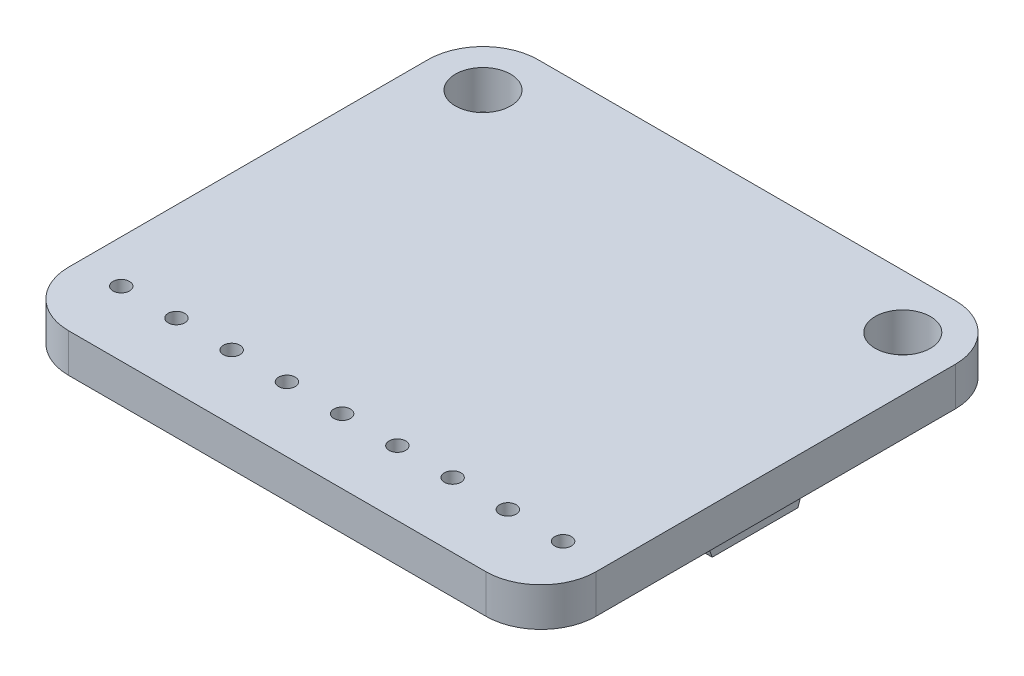
from build123d import *

# Parameters (mm, degrees)
SKETCH1_R           = 1.27
BOSS_EXTRUDE1_DEPTH = 1.778
SKETCH2_W           = 13.208
SKETCH2_H           = 2.667
BOSS_EXTRUDE2_DEPTH = 2.159
SKETCH3_R           = 0.381
CUT_EXTRUDE1_DEPTH  = 17.707259088
SKETCH4_W           = 8.324333024
SKETCH4_H           = 3.537443828
CUT_EXTRUDE2_DEPTH  = 27.638231079
CUT_EXTRUDE3_DEPTH  = 0.0254
SKETCH7_W           = 7.62
SKETCH7_H           = 6.858
BOSS_EXTRUDE3_DEPTH = 8.636
CUT_EXTRUDE4_DEPTH  = 22.098538068


with BuildPart() as part:
    # Sketch1 → Boss-Extrude1 (new body)
    with BuildSketch(Plane(origin=(0, 0, 0), x_dir=(1, 0, 0), z_dir=(0, 1, 0))):
        with BuildLine():
            Line((9.5885, 10.795), (-9.5885, 10.795))
            ThreePointArc((-9.5885, 10.795), (-11.384551224, 10.051051224), (-12.1285, 8.255))
            Line((-12.1285, 8.255), (-12.1285, -8.255))
            ThreePointArc((-12.1285, -8.255), (-11.384551224, -10.051051224), (-9.5885, -10.795))
            Line((-9.5885, -10.795), (9.5885, -10.795))
            ThreePointArc((9.5885, -10.795), (11.384551224, -10.051051224), (12.1285, -8.255))
            Line((12.1285, -8.255), (12.1285, 8.255))
            ThreePointArc((12.1285, 8.255), (11.384551224, 10.051051224), (9.5885, 10.795))
        make_face()
        with Locations(Location((-9.652, 8.3185, 0), (0, 0, 270))):
            Circle(SKETCH1_R, mode=Mode.SUBTRACT)
        with Locations(Location((9.652, 8.3185, 0), (0, 0, 270))):
            Circle(SKETCH1_R, mode=Mode.SUBTRACT)
    extrude(amount=BOSS_EXTRUDE1_DEPTH)

    # Sketch2 → Boss-Extrude2 (add)
    with BuildSketch(Plane.XZ):
        with Locations((0, 7.8105)):
            Rectangle(SKETCH2_W, SKETCH2_H)
    extrude(amount=BOSS_EXTRUDE2_DEPTH)

    # Sketch3 → Cut-Extrude1 (cut, through all)
    with BuildSketch(Plane.XZ.offset(2.159)):
        with Locations(Location((-10.16, 7.8105, 0), (0, 0, 270))):
            Circle(SKETCH3_R)
        with Locations(Location((-7.62, 7.8105, 0), (0, 0, 270))):
            Circle(SKETCH3_R)
        with Locations(Location((-5.08, 7.8105, 0), (0, 0, 270))):
            Circle(SKETCH3_R)
        with Locations(Location((7.62, 7.8105, 0), (0, 0, 270))):
            Circle(SKETCH3_R)
        with Locations(Location((10.16, 7.8105, 0), (0, 0, 270))):
            Circle(SKETCH3_R)
        with Locations(Location((-2.54, 7.8105, 0), (0, 0, 270))):
            Circle(SKETCH3_R)
        with Locations(Location((2.54, 7.8105, 0), (0, 0, 270))):
            Circle(SKETCH3_R)
        with Locations(Location((5.08, 7.8105, 0), (0, 0, 270))):
            Circle(SKETCH3_R)
        with Locations(Location((0, 7.8105, 0), (0, 0, 270))):
            Circle(SKETCH3_R)
    extrude(amount=-CUT_EXTRUDE1_DEPTH, mode=Mode.SUBTRACT)

    # Sketch4 → Cut-Extrude2 (cut, through all)
    with BuildSketch(Plane.ZY.offset(12.1285)):
        with Locations((7.529971696, -1.768721914)):
            Rectangle(SKETCH4_W, SKETCH4_H)
    extrude(amount=-CUT_EXTRUDE2_DEPTH, mode=Mode.SUBTRACT)

    # Sketch5 → Cut-Extrude3 (cut)
    # profile 1 of 8: a face of its own
    with BuildSketch(Plane.XZ):
        Polygon((-10.354641993, -1.090005859), (-9.935506376, 2.084994141), (-9.894801248, 2.084994141), (-8.583968916, -0.520134064), (-7.276316672, 2.084994141), (-7.234975526, 2.084994141), (-6.813295839, -1.090005859), (-7.099503772, -1.090005859), (-7.403520198, 1.194569461), (-8.549623964, -1.090005859), (-8.613861744, -1.090005859), (-9.764417634, 1.199657602), (-10.067798042, -1.090005859), align=None)
    # profile 2 of 8: a face of its own
    with BuildSketch(Plane.XZ):
        Polygon((-4.859449685, 2.084994141), (-3.39406507, -1.090005859), (-3.703805655, -1.090005859), (-4.173186664, -0.072377654), (-5.612494557, -0.072377654), (-6.095231937, -1.090005859), (-6.406244557, -1.090005859), (-4.900154813, 2.084994141), align=None)
        Polygon((-4.882982337, 1.466148989), (-5.457942273, 0.253263372), (-4.323286825, 0.253263372), align=None, mode=Mode.SUBTRACT)
    # profile 3 of 8: a face of its own
    with BuildSketch(Plane.XZ):
        Polygon((-3.04807148, 2.084994141), (-2.719250366, 2.084994141), (-1.887975326, 0.786246144), (-1.056700286, 2.084994141), (-0.727879172, 2.084994141), (-1.72324676, 0.529295022), (-0.687174044, -1.090005859), (-1.015995158, -1.090005859), (-1.887975326, 0.2723439), (-2.759955494, -1.090005859), (-3.088776608, -1.090005859), (-2.052067874, 0.529295022), align=None)
    # profile 4 of 8: a face of its own
    with BuildSketch(Plane.XZ):
        with BuildLine():
            Line((-0.015539429, 1.352301833), (-0.300475326, 1.352301833))
            add(Edge.make_bspline(
                [(-0.300475326, 1.352301833), (-0.292755948, 1.384262729), (-0.277665195, 1.446743667), (-0.246189539, 1.536013111), (-0.211900215, 1.620489448), (-0.170725813, 1.698590886), (-0.1258143, 1.771887034), (-0.074358688, 1.838715454), (-0.01873294, 1.900775787), (0.042793978, 1.955851367), (0.107317836, 2.005724021), (0.175747812, 2.048246395), (0.246707151, 2.084826162), (0.320687493, 2.114961658), (0.397909092, 2.137663383), (0.477673822, 2.154134199), (0.560190711, 2.164830424), (0.616204597, 2.165874331), (0.644646869, 2.166404397)],
                knots=[0, 0, 0, 0, 1.162005537, 2.271625781, 3.343758855, 4.383309926, 5.390229558, 6.379919256, 7.361854164, 8.333198761, 9.295911338, 10.242430842, 11.177959212, 12.116337295, 13.062827104, 14.020064771, 14.994644689, 16, 16, 16, 16], degree=3))
            add(Edge.make_bspline(
                [(0.644646869, 2.166404397), (0.686087643, 2.165153238), (0.768065245, 2.162678212), (0.888500295, 2.140077259), (1.00463891, 2.104313032), (1.11520987, 2.054897579), (1.217915162, 1.993949088), (1.309297275, 1.921409648), (1.388117567, 1.838678853), (1.454243181, 1.747300027), (1.506018358, 1.649641101), (1.544196712, 1.54912953), (1.567439236, 1.446003741), (1.570451456, 1.376373924), (1.571960571, 1.341489533)],
                knots=[0, 0, 0, 0, 1.083050992, 2.142477498, 3.193116406, 4.255571735, 5.30263384, 6.308962982, 7.297363603, 8.282367274, 9.249857812, 10.179914175, 11.08814088, 12, 12, 12, 12], degree=3))
            add(Edge.make_bspline(
                [(1.571960571, 1.341489533), (1.570905028, 1.307919084), (1.568839494, 1.242226924), (1.551301061, 1.146322423), (1.521786022, 1.055933257), (1.480901309, 0.970678917), (1.427977188, 0.891099955), (1.363866956, 0.817017326), (1.288118113, 0.748102446), (1.230715076, 0.708624067), (1.201162294, 0.688299429)],
                knots=[0, 0, 0, 0, 1.024540389, 2.004866551, 2.965041327, 3.920577974, 4.882998113, 5.874504559, 6.905732034, 8, 8, 8, 8], degree=3))
            add(Edge.make_bspline(
                [(1.201162294, 0.688299429), (1.234936814, 0.671990659), (1.301853907, 0.639678269), (1.393067602, 0.576309118), (1.475869675, 0.503142288), (1.52204662, 0.44604431), (1.545247831, 0.41735592)],
                knots=[0, 0, 0, 0, 1.015518401, 2.012035669, 3.001164323, 4, 4, 4, 4], degree=3))
            add(Edge.make_bspline(
                [(1.545247831, 0.41735592), (1.560525334, 0.396439245), (1.590830161, 0.354948421), (1.628236681, 0.288240377), (1.662172092, 0.220792955), (1.688615505, 0.150798351), (1.709093228, 0.079067831), (1.723730914, 0.005478229), (1.732824242, -0.070030548), (1.734126492, -0.121114013), (1.734781084, -0.146791717)],
                knots=[0, 0, 0, 0, 1.025084078, 2.033381695, 3.024893161, 4.013698104, 4.991890475, 5.976764909, 6.982997093, 8, 8, 8, 8], degree=3))
            add(Edge.make_bspline(
                [(1.734781084, -0.146791717), (1.733153204, -0.191250535), (1.729905105, -0.279958948), (1.700872837, -0.41101816), (1.65586654, -0.539129866), (1.591952034, -0.661662041), (1.514057937, -0.776307101), (1.42138665, -0.878883467), (1.314991122, -0.967056487), (1.196331712, -1.040725765), (1.067774031, -1.099615594), (0.930273316, -1.140489132), (0.785810767, -1.167110146), (0.686744147, -1.169964806), (0.63637864, -1.171416116)],
                knots=[0, 0, 0, 0, 0.955779014, 1.907060117, 2.875433937, 3.871313158, 4.872415639, 5.851225146, 6.836215519, 7.83643374, 8.849228613, 9.86973379, 10.916971861, 12, 12, 12, 12], degree=3))
            add(Edge.make_bspline(
                [(0.63637864, -1.171416116), (0.602433989, -1.170628522), (0.535642235, -1.169078801), (0.437449919, -1.158484641), (0.343722377, -1.139135279), (0.254332885, -1.113097281), (0.169202031, -1.080084772), (0.088589592, -1.038974239), (0.011999618, -0.99061309), (-0.059845145, -0.934430479), (-0.126936132, -0.871582406), (-0.187490389, -0.800953161), (-0.242517487, -0.723848374), (-0.290544023, -0.639372458), (-0.333757544, -0.548617118), (-0.369300269, -0.450420266), (-0.400583607, -0.34565976), (-0.415128249, -0.272654953), (-0.422590711, -0.235198167)],
                knots=[0, 0, 0, 0, 1.048658725, 2.063410685, 3.046034179, 4.001477787, 4.936774919, 5.862367409, 6.792675028, 7.730719943, 8.675894397, 9.627829632, 10.600096036, 11.597688215, 12.626045268, 13.701542398, 14.82072376, 16, 16, 16, 16], degree=3))
            Line((-0.422590711, -0.235198167), (-0.137654813, -0.235198167))
            add(Edge.make_bspline(
                [(-0.137654813, -0.235198167), (-0.130231399, -0.259644772), (-0.115792213, -0.307195542), (-0.091213814, -0.375630676), (-0.063211882, -0.43836691), (-0.033172246, -0.495864457), (-0.001623227, -0.548689564), (0.033678169, -0.595445403), (0.070117322, -0.638185622), (0.097585021, -0.662265377), (0.111028079, -0.67405033)],
                knots=[0, 0, 0, 0, 1.198163088, 2.33053128, 3.407730985, 4.417276592, 5.372219308, 6.28897303, 7.162600585, 8, 8, 8, 8], degree=3))
            add(Edge.make_bspline(
                [(0.111028079, -0.67405033), (0.128804974, -0.687755747), (0.164303889, -0.715124276), (0.222150785, -0.750050754), (0.282988217, -0.780313969), (0.348134386, -0.803431322), (0.416183499, -0.823005343), (0.488235466, -0.835814671), (0.563654613, -0.844603226), (0.615151084, -0.845378771), (0.641466781, -0.84577509)],
                knots=[0, 0, 0, 0, 0.946170439, 1.889420265, 2.845303464, 3.807233317, 4.801018734, 5.828864929, 6.890507805, 8, 8, 8, 8], degree=3))
            add(Edge.make_bspline(
                [(0.641466781, -0.84577509), (0.671178887, -0.845216376), (0.729278345, -0.844123859), (0.814055254, -0.83407661), (0.89470701, -0.819444021), (0.970338164, -0.796844387), (1.04193941, -0.768921757), (1.108507049, -0.733862132), (1.170914945, -0.692727992), (1.228363763, -0.645974612), (1.280021473, -0.594792256), (1.325505175, -0.54125897), (1.364171832, -0.485600468), (1.395362649, -0.427508744), (1.419992077, -0.367224357), (1.43675898, -0.304578134), (1.448417141, -0.240082756), (1.449366567, -0.196241477), (1.449845187, -0.174140475)],
                knots=[0, 0, 0, 0, 1.217147791, 2.380027433, 3.494444702, 4.572153297, 5.609568379, 6.639424714, 7.649109417, 8.668170816, 9.669597737, 10.625200337, 11.543417969, 12.441394052, 13.322311151, 14.205496177, 15.095365482, 16, 16, 16, 16], degree=3))
            add(Edge.make_bspline(
                [(1.449845187, -0.174140475), (1.448456985, -0.144557331), (1.445687488, -0.085538247), (1.424543277, 0.001291267), (1.38976445, 0.084951077), (1.341075814, 0.164013829), (1.281806975, 0.237289111), (1.212533095, 0.302668242), (1.132678917, 0.35661611), (1.059182321, 0.393889391), (0.994081072, 0.419323024), (0.938368545, 0.436263885), (0.875996483, 0.450609129), (0.807719152, 0.463955261), (0.733022092, 0.475313913), (0.651986623, 0.484786131), (0.564596325, 0.492365347), (0.50409791, 0.495749984), (0.47292211, 0.497494141)],
                knots=[0, 0, 0, 0, 1.07054697, 2.135767047, 3.216561865, 4.33974944, 5.486079747, 6.621378074, 7.775625952, 8.963672916, 9.598146892, 10.304877434, 11.070270905, 11.915000392, 12.823868403, 13.805723172, 14.86925407, 16, 16, 16, 16], degree=3))
            Line((0.47292211, 0.497494141), (0.47292211, 0.823135166))
            add(Edge.make_bspline(
                [(0.47292211, 0.823135166), (0.512202453, 0.823801738), (0.589142996, 0.825107389), (0.70153283, 0.840898941), (0.809005048, 0.862743511), (0.909177879, 0.89620365), (1.00048064, 0.935065919), (1.079691993, 0.980288995), (1.145702191, 1.030558089), (1.198190449, 1.086649099), (1.237677678, 1.14680632), (1.26654913, 1.209505003), (1.283603711, 1.275294687), (1.285880338, 1.320193421), (1.287024674, 1.342761569)],
                knots=[0, 0, 0, 0, 1.321986639, 2.589447074, 3.816329219, 5.01088745, 6.139805852, 7.153945165, 8.075214402, 8.924034688, 9.728124013, 10.488707548, 11.240355623, 12, 12, 12, 12], degree=3))
            add(Edge.make_bspline(
                [(1.287024674, 1.342761569), (1.286648744, 1.359342095), (1.285900849, 1.392328265), (1.276469033, 1.440520291), (1.262295796, 1.487239007), (1.242810613, 1.532285734), (1.216730075, 1.575348054), (1.18551893, 1.616793097), (1.148355011, 1.65638424), (1.105768784, 1.693287101), (1.060038075, 1.728456338), (1.009918636, 1.758313708), (0.95692165, 1.7838453), (0.900988442, 1.804899634), (0.841937496, 1.820737703), (0.780046262, 1.832109502), (0.71519672, 1.839219374), (0.670953792, 1.840243009), (0.648462975, 1.840763372)],
                knots=[0, 0, 0, 0, 0.884392785, 1.759457502, 2.611959086, 3.489218968, 4.37281399, 5.2945488, 6.255912374, 7.266815255, 8.301784654, 9.332968512, 10.37626691, 11.440494194, 12.520033166, 13.637162961, 14.798855837, 16, 16, 16, 16], degree=3))
            add(Edge.make_bspline(
                [(0.648462975, 1.840763372), (0.612311819, 1.839501208), (0.541700203, 1.837035907), (0.439905243, 1.815443174), (0.345272704, 1.780991627), (0.272938343, 1.739868102), (0.219523436, 1.699273065), (0.181353642, 1.663819758), (0.143870036, 1.624419982), (0.109538601, 1.578647027), (0.074818636, 1.529600725), (0.043209641, 1.474787814), (0.012494063, 1.415638113), (-0.006013964, 1.373822788), (-0.015539429, 1.352301833)],
                knots=[0, 0, 0, 0, 1.472543308, 2.876219568, 4.221790263, 5.565193594, 6.249813518, 6.953379497, 7.687249741, 8.463570142, 9.283606569, 10.136032583, 11.040678096, 12, 12, 12, 12], degree=3))
        make_face()
    # profile 5 of 8: a face of its own
    with BuildSketch(Plane.XZ):
        Polygon((2.694531685, 2.084994141), (3.281575956, 2.084994141), (3.281575956, -1.090005859), (2.996640058, -1.090005859), (2.996640058, 1.759353115), (2.50817852, 1.759353115), align=None)
    # profile 6 of 8: a face of its own
    with BuildSketch(Plane.XZ):
        with BuildLine():
            add(Edge.make_bspline(
                [(6.005639458, 0.678759165), (6.031627782, 0.665208305), (6.082313695, 0.638779602), (6.154501591, 0.59622478), (6.220473557, 0.551374762), (6.282059995, 0.506347946), (6.338178892, 0.459419948), (6.388202752, 0.410404157), (6.433367236, 0.360524049), (6.472761533, 0.30893498), (6.50741152, 0.255774005), (6.537358243, 0.200901593), (6.562955277, 0.144437998), (6.583241657, 0.085766873), (6.599952854, 0.025750065), (6.611451438, -0.03638739), (6.617635357, -0.100236042), (6.618804495, -0.143387287), (6.619396469, -0.165236228)],
                knots=[0, 0, 0, 0, 1.272397273, 2.481599622, 3.635517121, 4.734568067, 5.792894095, 6.808321871, 7.773003508, 8.711915296, 9.623354172, 10.525449501, 11.423591555, 12.311487226, 13.218079475, 14.126165749, 15.051214107, 16, 16, 16, 16], degree=3))
            add(Edge.make_bspline(
                [(6.619396469, -0.165236228), (6.61869668, -0.195804885), (6.617311536, -0.256311728), (6.60524655, -0.345616415), (6.587182634, -0.43234996), (6.560803362, -0.516493348), (6.526591929, -0.59758228), (6.484430799, -0.675686167), (6.43670492, -0.752085112), (6.398376103, -0.799092712), (6.378981805, -0.822878455)],
                knots=[0, 0, 0, 0, 1.025265484, 2.029385089, 3.018602448, 3.995076438, 4.983346944, 5.966715145, 6.97116228, 8, 8, 8, 8], degree=3))
            add(Edge.make_bspline(
                [(6.378981805, -0.822878455), (6.353730146, -0.850631379), (6.303538871, -0.905794276), (6.217557215, -0.977413939), (6.123194506, -1.037602318), (6.020815876, -1.086653251), (5.910694991, -1.124831137), (5.792855315, -1.152265422), (5.667067119, -1.167979339), (5.580611442, -1.170250816), (5.536258448, -1.171416116)],
                knots=[0, 0, 0, 0, 0.954267603, 1.896743057, 2.838368354, 3.796610408, 4.779680527, 5.799409237, 6.871065594, 8, 8, 8, 8], degree=3))
            add(Edge.make_bspline(
                [(5.536258448, -1.171416116), (5.493610588, -1.170370653), (5.410622185, -1.16833629), (5.289828968, -1.15455277), (5.177231611, -1.130397491), (5.072175426, -1.097337024), (4.975293754, -1.054329174), (4.886862655, -1.000800118), (4.805606266, -0.938904452), (4.733990536, -0.866864538), (4.670410305, -0.789704897), (4.614559286, -0.710101651), (4.568137086, -0.628047534), (4.528833221, -0.544766044), (4.498745086, -0.45908989), (4.477906009, -0.371459878), (4.464671417, -0.28202907), (4.462910531, -0.221675355), (4.462024674, -0.19131295)],
                knots=[0, 0, 0, 0, 1.256902934, 2.445805442, 3.576955095, 4.645999104, 5.686449165, 6.692658513, 7.68621702, 8.689161843, 9.678783111, 10.630372946, 11.551080876, 12.453998257, 13.34127905, 14.221779781, 15.105423033, 16, 16, 16, 16], degree=3))
            add(Edge.make_bspline(
                [(4.462024674, -0.19131295), (4.462548895, -0.169034255), (4.46358494, -0.125003689), (4.470755766, -0.059953084), (4.482284156, 0.003361981), (4.497940949, 0.06517537), (4.519159952, 0.125037067), (4.544779601, 0.183230711), (4.574653586, 0.239822001), (4.609198643, 0.295120415), (4.649386908, 0.348351115), (4.694892504, 0.400417482), (4.746624928, 0.450511604), (4.804008662, 0.499245518), (4.866387922, 0.547483723), (4.935382968, 0.592619277), (5.009164768, 0.637847573), (5.061602529, 0.664887983), (5.088502038, 0.678759165)],
                knots=[0, 0, 0, 0, 0.941657376, 1.861047343, 2.762797495, 3.66048619, 4.553285746, 5.444104102, 6.34607688, 7.256116206, 8.197091036, 9.162375105, 10.176350973, 11.237807142, 12.343728897, 13.50695164, 14.721116704, 16, 16, 16, 16], degree=3))
            add(Edge.make_bspline(
                [(5.088502038, 0.678759165), (5.051679862, 0.698838562), (4.980381824, 0.737717895), (4.885975973, 0.809152498), (4.804885908, 0.88652073), (4.739340557, 0.97145633), (4.687749321, 1.061305994), (4.652353873, 1.155507566), (4.628408491, 1.252314326), (4.626036469, 1.318450662), (4.624845187, 1.351665816)],
                knots=[0, 0, 0, 0, 1.166880483, 2.259407225, 3.286803203, 4.280235371, 5.237608625, 6.161067461, 7.076446754, 8, 8, 8, 8], degree=3))
            add(Edge.make_bspline(
                [(4.624845187, 1.351665816), (4.62632875, 1.385500029), (4.629310971, 1.453512699), (4.65342584, 1.554755397), (4.692723329, 1.654193281), (4.746173091, 1.751344392), (4.81274578, 1.842920658), (4.892616575, 1.925054231), (4.983878137, 1.997001075), (5.086074916, 2.057395175), (5.196053502, 2.106547494), (5.312091337, 2.140455063), (5.432166656, 2.162622112), (5.513898158, 2.165131863), (5.555338977, 2.166404397)],
                knots=[0, 0, 0, 0, 0.888701115, 1.786444228, 2.72001202, 3.692817113, 4.693886446, 5.687152267, 6.695133018, 7.739871481, 8.800368666, 9.853104506, 10.91144658, 12, 12, 12, 12], degree=3))
            add(Edge.make_bspline(
                [(5.555338977, 2.166404397), (5.595710295, 2.165092357), (5.675317934, 2.162505164), (5.792334489, 2.140927068), (5.904298485, 2.104886718), (6.010823816, 2.055994237), (6.110003439, 1.995771797), (6.197635534, 1.922836719), (6.275044376, 1.841065455), (6.339074505, 1.749516958), (6.391836555, 1.652739153), (6.428576658, 1.551481581), (6.452118806, 1.447932078), (6.455088215, 1.377866174), (6.456575956, 1.342761569)],
                knots=[0, 0, 0, 0, 1.072916533, 2.115669174, 3.151510826, 4.193348718, 5.225979165, 6.227137561, 7.216255879, 8.211077061, 9.189680878, 10.138522389, 11.067357538, 12, 12, 12, 12], degree=3))
            add(Edge.make_bspline(
                [(6.456575956, 1.342761569), (6.455274604, 1.308311309), (6.452718824, 1.240652958), (6.431219593, 1.142022472), (6.395012516, 1.049655336), (6.345578525, 0.962503444), (6.281148262, 0.882147371), (6.202581768, 0.807565288), (6.110505427, 0.738144522), (6.041325909, 0.69896832), (6.005639458, 0.678759165)],
                knots=[0, 0, 0, 0, 0.975232327, 1.915300861, 2.843280834, 3.77672583, 4.742871857, 5.749627742, 6.839139064, 8, 8, 8, 8], degree=3))
        make_face()
        with BuildLine():
            add(Edge.make_bspline(
                [(5.539438536, 1.840763372), (5.517167448, 1.840172422), (5.473595461, 1.839016266), (5.409706595, 1.832975931), (5.348953091, 1.821225513), (5.290700186, 1.805587539), (5.235746549, 1.784462007), (5.183345846, 1.75961082), (5.134389895, 1.72939746), (5.088287713, 1.695505517), (5.046785225, 1.65822838), (5.009951096, 1.619390221), (4.979354878, 1.578228258), (4.9533733, 1.535766389), (4.934521495, 1.490744367), (4.920402448, 1.444542514), (4.910858043, 1.396576987), (4.91014286, 1.363796009), (4.909781084, 1.347213692)],
                knots=[0, 0, 0, 0, 1.203892937, 2.355340988, 3.463153438, 4.544400666, 5.610487187, 6.640501085, 7.674077295, 8.714426146, 9.728707835, 10.68524104, 11.601827946, 12.495867327, 13.368432065, 14.231010473, 15.105153427, 16, 16, 16, 16], degree=3))
            add(Edge.make_bspline(
                [(4.909781084, 1.347213692), (4.910404624, 1.330630658), (4.911636829, 1.297860202), (4.921166481, 1.24946788), (4.935369485, 1.201913967), (4.957731156, 1.156329212), (4.984552067, 1.111132308), (5.017655049, 1.067452848), (5.05710581, 1.02513882), (5.101580702, 0.984550127), (5.150032597, 0.946541963), (5.201362408, 0.913546291), (5.25492592, 0.885938205), (5.310172797, 0.862960817), (5.367666103, 0.845099231), (5.427053546, 0.832427673), (5.488345109, 0.824551861), (5.529874636, 0.823611135), (5.550886853, 0.823135166)],
                knots=[0, 0, 0, 0, 0.873023192, 1.725219244, 2.590779336, 3.480155217, 4.391973325, 5.357036234, 6.360879153, 7.436073238, 8.526419356, 9.601555421, 10.645666583, 11.697338044, 12.750135903, 13.812665442, 14.89329948, 16, 16, 16, 16], degree=3))
            add(Edge.make_bspline(
                [(5.550886853, 0.823135166), (5.577874448, 0.823926982), (5.631583081, 0.825502791), (5.710757903, 0.840154213), (5.787740445, 0.86320101), (5.86170788, 0.894733265), (5.930745611, 0.934309967), (5.992286244, 0.981692776), (6.045804854, 1.035787607), (6.090745265, 1.095752322), (6.125588482, 1.159571263), (6.152713694, 1.223615814), (6.168553511, 1.288569267), (6.170619589, 1.332082155), (6.171640058, 1.353573868)],
                knots=[0, 0, 0, 0, 1.076279235, 2.141928126, 3.20205304, 4.278698113, 5.344010996, 6.36967002, 7.368914609, 8.37248503, 9.349703398, 10.264243087, 11.142681841, 12, 12, 12, 12], degree=3))
            add(Edge.make_bspline(
                [(6.171640058, 1.353573868), (6.171157551, 1.368657872), (6.170199844, 1.398597458), (6.16230765, 1.442810118), (6.149266716, 1.486016955), (6.131610922, 1.5285749), (6.10837918, 1.56988685), (6.080834524, 1.610602223), (6.047375012, 1.649805094), (6.009822533, 1.688409056), (5.967236341, 1.724135992), (5.919698506, 1.755554622), (5.867452747, 1.782235831), (5.810497828, 1.803906344), (5.749043504, 1.820182619), (5.683372825, 1.832371306), (5.61293822, 1.8392412), (5.564469803, 1.840244976), (5.539438536, 1.840763372)],
                knots=[0, 0, 0, 0, 0.814439003, 1.616544685, 2.417341072, 3.248991801, 4.09997495, 4.973547432, 5.9003056, 6.880240646, 7.880314356, 8.896779544, 9.951930927, 11.043077905, 12.18215768, 13.381699519, 14.647792085, 16, 16, 16, 16], degree=3))
        make_face(mode=Mode.SUBTRACT)
        with BuildLine():
            add(Edge.make_bspline(
                [(5.557883047, 0.497494141), (5.529647513, 0.496991909), (5.474256285, 0.496006653), (5.393106072, 0.485039749), (5.315224986, 0.469773085), (5.240875615, 0.446612967), (5.170089356, 0.416499008), (5.102483008, 0.380272676), (5.038573769, 0.337450595), (4.979244153, 0.288576808), (4.925066561, 0.235908589), (4.877533818, 0.180153652), (4.83716821, 0.122348212), (4.804662332, 0.061758118), (4.777981689, -0.000333643), (4.760461244, -0.06547339), (4.749229262, -0.132408843), (4.747721018, -0.177911218), (4.746960571, -0.200853215)],
                knots=[0, 0, 0, 0, 1.140299081, 2.23698856, 3.303958914, 4.344563908, 5.37730929, 6.408454204, 7.439741482, 8.480804886, 9.510774543, 10.48932336, 11.43758569, 12.353841022, 13.263987381, 14.161954604, 15.073269652, 16, 16, 16, 16], degree=3))
            add(Edge.make_bspline(
                [(4.746960571, -0.200853215), (4.748197242, -0.229365537), (4.750650767, -0.285933318), (4.770115004, -0.369538389), (4.801352954, -0.450474632), (4.844918685, -0.528082475), (4.898864269, -0.600608643), (4.965200422, -0.663826318), (5.039804611, -0.719997945), (5.125201093, -0.765428143), (5.218481201, -0.80170919), (5.319620127, -0.826706385), (5.427166374, -0.843253986), (5.501424719, -0.844921479), (5.539438536, -0.84577509)],
                knots=[0, 0, 0, 0, 0.898778495, 1.783155532, 2.693654817, 3.627872908, 4.583023416, 5.533784346, 6.509005473, 7.520592997, 8.575161974, 9.658835044, 10.801527049, 12, 12, 12, 12], degree=3))
            add(Edge.make_bspline(
                [(5.539438536, -0.84577509), (5.569147798, -0.845204671), (5.627030968, -0.844093312), (5.711473222, -0.834283202), (5.791160777, -0.818726042), (5.865939101, -0.796098683), (5.936645299, -0.768476204), (6.002080556, -0.73294153), (6.063928219, -0.692526209), (6.119140674, -0.644576309), (6.169426513, -0.593341339), (6.213271714, -0.539103229), (6.251333207, -0.483336048), (6.281206288, -0.424779537), (6.305087961, -0.364557121), (6.322254329, -0.302113479), (6.332846324, -0.237257089), (6.333917565, -0.193261503), (6.334460571, -0.170960386)],
                knots=[0, 0, 0, 0, 1.224942928, 2.386581632, 3.501229538, 4.569074225, 5.605009692, 6.626002462, 7.634866581, 8.645888296, 9.63523824, 10.59253846, 11.518950513, 12.414518923, 13.29783783, 14.186679152, 15.080837789, 16, 16, 16, 16], degree=3))
            add(Edge.make_bspline(
                [(6.334460571, -0.170960386), (6.333638837, -0.149300227), (6.332018521, -0.106590178), (6.321734523, -0.043301971), (6.303667977, 0.01784201), (6.278878124, 0.077577373), (6.245875394, 0.134693764), (6.207008976, 0.190679148), (6.160115025, 0.243979637), (6.107126456, 0.295009231), (6.049378685, 0.342194935), (5.987994917, 0.383936604), (5.923447655, 0.41909031), (5.855873486, 0.447680273), (5.785422453, 0.470166049), (5.712146375, 0.485874131), (5.635959461, 0.495761628), (5.584202542, 0.496910112), (5.557883047, 0.497494141)],
                knots=[0, 0, 0, 0, 0.917430815, 1.809013306, 2.70690318, 3.612392954, 4.541220862, 5.495268465, 6.494511384, 7.542276156, 8.608045339, 9.649016899, 10.681629292, 11.715607085, 12.752076957, 13.808767841, 14.885711793, 16, 16, 16, 16], degree=3))
        make_face(mode=Mode.SUBTRACT)
    # profile 7 of 8: a face of its own
    with BuildSketch(Plane.XZ):
        with BuildLine():
            Line((8.898883648, 2.084994141), (8.898883648, 1.759353115))
            Line((8.898883648, 1.759353115), (7.818925716, 1.759353115))
            Line((7.818925716, 1.759353115), (7.647836974, 0.924261969))
            add(Edge.make_bspline(
                [(7.647836974, 0.924261969), (7.681451945, 0.933542287), (7.746575637, 0.951521436), (7.842696368, 0.971483813), (7.933947866, 0.983517466), (7.993161952, 0.985160583), (8.021815339, 0.985955679)],
                knots=[0, 0, 0, 0, 1.100273476, 2.13160584, 3.095893838, 4, 4, 4, 4], degree=3))
            add(Edge.make_bspline(
                [(8.021815339, 0.985955679), (8.057269874, 0.985188295), (8.126982349, 0.983679425), (8.228980537, 0.969190676), (8.326346804, 0.946385182), (8.418877526, 0.914525852), (8.506743882, 0.873786308), (8.589137456, 0.822895648), (8.667294991, 0.763447554), (8.739814344, 0.695098865), (8.805604252, 0.619877113), (8.863449114, 0.538998187), (8.912582321, 0.453248093), (8.952098149, 0.361807541), (8.983652509, 0.265687452), (9.004654676, 0.163876466), (9.018639834, 0.057334243), (9.020202284, -0.015513474), (9.020999033, -0.052661108)],
                knots=[0, 0, 0, 0, 1.052922333, 2.070308379, 3.05430497, 4.020497103, 4.973039431, 5.925935799, 6.892292201, 7.88610001, 8.88166317, 9.857072816, 10.836096531, 11.812156883, 12.81219415, 13.836441305, 14.89672472, 16, 16, 16, 16], degree=3))
            add(Edge.make_bspline(
                [(9.020999033, -0.052661108), (9.020395715, -0.078534836), (9.019197231, -0.129932632), (9.013102513, -0.206263443), (9.00136797, -0.280978298), (8.985612963, -0.354087111), (8.96516377, -0.42545147), (8.940408699, -0.495275642), (8.910113732, -0.563125035), (8.876883841, -0.629641643), (8.839467393, -0.693321718), (8.797939747, -0.752874727), (8.754065337, -0.809194039), (8.706856366, -0.86167564), (8.655874035, -0.909974663), (8.601735779, -0.954377747), (8.544873599, -0.995635811), (8.484407772, -1.032074103), (8.421685662, -1.065604784), (8.355801494, -1.093112565), (8.288255001, -1.117705686), (8.218074007, -1.137308615), (8.145417477, -1.152668861), (8.070165645, -1.163101549), (7.99271318, -1.170700174), (7.940212276, -1.171175841), (7.913692342, -1.171416116)],
                knots=[0, 0, 0, 0, 1.056347294, 2.098418968, 3.122841568, 4.141288669, 5.149314143, 6.15115421, 7.162517403, 8.180376062, 9.185164535, 10.17417709, 11.141909838, 12.097768115, 13.052685741, 14.0056014, 14.954263652, 15.917497458, 16.885230207, 17.854509472, 18.828990115, 19.81800267, 20.826176721, 21.857883937, 22.917946725, 24, 24, 24, 24], degree=3))
            add(Edge.make_bspline(
                [(7.913692342, -1.171416116), (7.882056478, -1.170789427), (7.819816653, -1.169556491), (7.728630139, -1.156658293), (7.640896175, -1.138185312), (7.557321012, -1.110393839), (7.477155651, -1.075571079), (7.401479329, -1.03155998), (7.328358375, -0.981686079), (7.260765313, -0.92283033), (7.198030838, -0.858499676), (7.141872791, -0.788688101), (7.091858761, -0.714547822), (7.048789662, -0.635718782), (7.012052171, -0.552408114), (6.983191432, -0.464303678), (6.959897495, -0.371865817), (6.950042821, -0.308226561), (6.945037494, -0.275903295)],
                knots=[0, 0, 0, 0, 1.0467383, 2.05933395, 3.04377827, 4.011590433, 4.970194871, 5.932262533, 6.905835911, 7.896367577, 8.894135286, 9.877477877, 10.858688626, 11.851381753, 12.8477658, 13.868841284, 14.917554742, 16, 16, 16, 16], degree=3))
            Line((6.945037494, -0.275903295), (7.229973392, -0.275903295))
            add(Edge.make_bspline(
                [(7.229973392, -0.275903295), (7.236984297, -0.306180505), (7.250459647, -0.364374985), (7.280037719, -0.446136988), (7.316201764, -0.518997998), (7.35920428, -0.583921834), (7.410503236, -0.64053571), (7.469040646, -0.69098833), (7.534670367, -0.736504341), (7.607598511, -0.774443565), (7.68453609, -0.80680022), (7.76506063, -0.8283464), (7.846979573, -0.843496496), (7.90238638, -0.845013022), (7.9302288, -0.84577509)],
                knots=[0, 0, 0, 0, 1.136247022, 2.183929868, 3.172523383, 4.106158343, 5.02341133, 5.958108904, 6.928429099, 7.938127109, 8.96079061, 9.975095812, 10.982467395, 12, 12, 12, 12], degree=3))
            add(Edge.make_bspline(
                [(7.9302288, -0.84577509), (7.957405389, -0.845030527), (8.010916315, -0.843564477), (8.089666645, -0.832280516), (8.165696895, -0.814901862), (8.238256854, -0.788894208), (8.308616251, -0.75728507), (8.374995314, -0.716722109), (8.439314352, -0.670040521), (8.499574159, -0.616558435), (8.554764231, -0.55762164), (8.603528712, -0.494595719), (8.64414777, -0.427361151), (8.678377997, -0.357081934), (8.704370632, -0.282987814), (8.722913522, -0.205426034), (8.733802011, -0.124205016), (8.735299868, -0.068806428), (8.736063135, -0.040576773)],
                knots=[0, 0, 0, 0, 1.027316725, 2.022795036, 3.002884548, 3.971462791, 4.93288096, 5.914575861, 6.907176829, 7.935150275, 8.956128384, 9.956726525, 10.942570165, 11.921478529, 12.907843606, 13.90538589, 14.932640048, 16, 16, 16, 16], degree=3))
            add(Edge.make_bspline(
                [(8.736063135, -0.040576773), (8.7354658, -0.015108055), (8.734296602, 0.034743336), (8.724743871, 0.107676902), (8.70812776, 0.176686019), (8.685064669, 0.242103931), (8.655782544, 0.303992339), (8.619999104, 0.362415115), (8.577042807, 0.416602235), (8.527973737, 0.466579052), (8.474218228, 0.512702617), (8.414851404, 0.552021895), (8.351115614, 0.585099878), (8.283778763, 0.613645848), (8.211239176, 0.634147952), (8.134933374, 0.649540249), (8.05403736, 0.658444185), (7.998728236, 0.659679612), (7.970297911, 0.660314654)],
                knots=[0, 0, 0, 0, 1.045622112, 2.046656509, 3.013763289, 3.955457236, 4.890082067, 5.820317437, 6.762574623, 7.722996705, 8.69280354, 9.665887285, 10.63943826, 11.638615906, 12.663482002, 13.728887084, 14.832589034, 16, 16, 16, 16], degree=3))
            add(Edge.make_bspline(
                [(7.970297911, 0.660314654), (7.945688097, 0.659787975), (7.894875075, 0.658700516), (7.816930796, 0.650693622), (7.735023305, 0.637776548), (7.649466584, 0.620009024), (7.560003694, 0.596757975), (7.466823431, 0.568895535), (7.369729875, 0.535583437), (7.304308796, 0.510426357), (7.27067852, 0.497494141)],
                knots=[0, 0, 0, 0, 0.817624296, 1.688186739, 2.600797293, 3.572016777, 4.590301741, 5.671205678, 6.80286297, 8, 8, 8, 8], degree=3))
            Line((7.27067852, 0.497494141), (7.596319546, 2.084994141))
            Line((7.596319546, 2.084994141), (8.898883648, 2.084994141))
        make_face()
    # profile 8 of 8: a face of its own
    with BuildSketch(Plane.XZ):
        with BuildLine():
            Line((10.812024674, 2.166404397), (11.031450756, 1.99404362))
            Line((11.031450756, 1.99404362), (10.192543504, 0.711196064))
            add(Edge.make_bspline(
                [(10.192543504, 0.711196064), (10.248396541, 0.720098638), (10.357344205, 0.737464114), (10.467621841, 0.740328822), (10.521364618, 0.74172491)],
                knots=[0, 0, 0, 0, 1.025318673, 2, 2, 2, 2], degree=3))
            add(Edge.make_bspline(
                [(10.521364618, 0.74172491), (10.553633954, 0.74085758), (10.617155181, 0.739150267), (10.710415638, 0.726011345), (10.800031315, 0.705305708), (10.885630778, 0.675123019), (10.967521268, 0.636567312), (11.046172728, 0.590358479), (11.120106694, 0.534110469), (11.190275264, 0.471277259), (11.253981274, 0.401683995), (11.310383838, 0.327841354), (11.357760999, 0.249826269), (11.3962002, 0.167678255), (11.426049625, 0.081523941), (11.447809846, -0.008526443), (11.460672762, -0.102534992), (11.462419458, -0.166468765), (11.463306725, -0.198945162)],
                knots=[0, 0, 0, 0, 1.04369286, 2.054478336, 3.041073146, 4.015093852, 4.984733326, 5.965804835, 6.960378782, 7.985147595, 9.009457201, 10.008161701, 10.986880575, 11.956520048, 12.937015923, 13.931873656, 14.949455224, 16, 16, 16, 16], degree=3))
            add(Edge.make_bspline(
                [(11.463306725, -0.198945162), (11.462015766, -0.243376751), (11.459475463, -0.330807602), (11.434162734, -0.458149328), (11.394829342, -0.579463825), (11.33860687, -0.692814202), (11.268772851, -0.798045104), (11.183612463, -0.891286205), (11.08614587, -0.974444024), (10.975939989, -1.043982529), (10.857337443, -1.100772439), (10.73273956, -1.141562338), (10.603356363, -1.166675199), (10.515540754, -1.169823532), (10.471119225, -1.171416116)],
                knots=[0, 0, 0, 0, 1.031375318, 2.029502543, 3.004789286, 3.987476834, 4.960371455, 5.9300674, 6.912260825, 7.929083631, 8.949397511, 9.960523116, 10.96833055, 12, 12, 12, 12], degree=3))
            add(Edge.make_bspline(
                [(10.471119225, -1.171416116), (10.42839579, -1.170029815), (10.343768144, -1.167283795), (10.219278395, -1.142821837), (10.099659801, -1.103173251), (9.985750434, -1.048550299), (9.88023102, -0.979554933), (9.785828622, -0.896494866), (9.70301394, -0.801145565), (9.634094106, -0.693521822), (9.579430828, -0.577870217), (9.53843711, -0.457277226), (9.514491946, -0.332182242), (9.511145898, -0.247381494), (9.509460571, -0.204669321)],
                knots=[0, 0, 0, 0, 1.012016664, 2.004627821, 2.994792927, 3.992885782, 4.990978636, 5.973936114, 6.964471063, 7.975201453, 8.993600317, 9.990122807, 10.98767138, 12, 12, 12, 12], degree=3))
            add(Edge.make_bspline(
                [(9.509460571, -0.204669321), (9.510532311, -0.171971734), (9.512720598, -0.105209511), (9.527999959, -0.004095714), (9.552551594, 0.09936491), (9.580047318, 0.187134786), (9.609099121, 0.259036309), (9.633276782, 0.317005904), (9.663370336, 0.376660592), (9.695459046, 0.440045962), (9.732431348, 0.505528461), (9.772631973, 0.574202505), (9.817172371, 0.64497591), (9.848396375, 0.693003859), (9.864358408, 0.71755624)],
                knots=[0, 0, 0, 0, 1.173818275, 2.396712641, 3.66331629, 4.989737886, 5.693666774, 6.447286557, 7.243889047, 8.091586357, 8.998013824, 9.943181721, 10.948533338, 12, 12, 12, 12], degree=3))
            Line((9.864358408, 0.71755624), (10.812024674, 2.166404397))
        make_face()
        with BuildLine():
            add(Edge.make_bspline(
                [(10.461578961, 0.416083884), (10.437392496, 0.415378088), (10.390149304, 0.413999462), (10.320836863, 0.405993697), (10.255238414, 0.390917831), (10.192484871, 0.371716944), (10.133749455, 0.345316311), (10.078605293, 0.313247179), (10.026839139, 0.275490825), (9.978993202, 0.232582141), (9.935613936, 0.185602997), (9.898256768, 0.135284216), (9.866032876, 0.082838475), (9.839832941, 0.02782757), (9.819431229, -0.029727469), (9.804673601, -0.089561931), (9.796460556, -0.152077051), (9.795094189, -0.194470108), (9.794396469, -0.216117638)],
                knots=[0, 0, 0, 0, 1.129588631, 2.206414736, 3.251139165, 4.268635594, 5.265702196, 6.250456724, 7.242448911, 8.251968645, 9.246821453, 10.222880186, 11.173611482, 12.116736599, 13.062300278, 14.020270554, 14.989073742, 16, 16, 16, 16], degree=3))
            add(Edge.make_bspline(
                [(9.794396469, -0.216117638), (9.794964668, -0.237571548), (9.796078822, -0.279639473), (9.80619557, -0.341632871), (9.821648823, -0.401291038), (9.844636182, -0.458306417), (9.872056288, -0.513548077), (9.908256118, -0.565015086), (9.948367059, -0.615833292), (9.996313127, -0.662098913), (10.047769321, -0.70514885), (10.102743269, -0.742777366), (10.160038375, -0.774968395), (10.220428165, -0.800197033), (10.283055842, -0.820901922), (10.348443202, -0.835471978), (10.416635721, -0.843709313), (10.462829193, -0.84507746), (10.486383648, -0.84577509)],
                knots=[0, 0, 0, 0, 0.989467248, 1.94019797, 2.891935182, 3.827694429, 4.772920941, 5.730924762, 6.725747692, 7.756678648, 8.79901574, 9.819492441, 10.826891316, 11.826466727, 12.835195252, 13.867842842, 14.912794438, 16, 16, 16, 16], degree=3))
            add(Edge.make_bspline(
                [(10.486383648, -0.84577509), (10.509938065, -0.845077405), (10.556131461, -0.843709151), (10.624324529, -0.835472594), (10.689709861, -0.820899663), (10.752344908, -0.800205222), (10.812707492, -0.774938019), (10.869952489, -0.742977634), (10.924406545, -0.704917442), (10.975896518, -0.662172482), (11.023643019, -0.615569966), (11.064715979, -0.565468718), (11.099807198, -0.513132113), (11.128322496, -0.458524027), (11.151056668, -0.401256564), (11.166588284, -0.341642107), (11.176684139, -0.279637055), (11.177801164, -0.237570732), (11.178370828, -0.216117638)],
                knots=[0, 0, 0, 0, 1.087397944, 2.132534446, 3.165364764, 4.174271784, 5.174024072, 6.181601208, 7.194203697, 8.236725232, 9.267838612, 10.269026844, 11.221737037, 12.171628256, 13.107553087, 14.05945871, 15.010357665, 16, 16, 16, 16], degree=3))
            add(Edge.make_bspline(
                [(11.178370828, -0.216117638), (11.177871633, -0.194441867), (11.176891877, -0.151899377), (11.165810267, -0.089589895), (11.150441113, -0.029423458), (11.12723365, 0.028221796), (11.097083356, 0.083118387), (11.060359122, 0.135543625), (11.01787529, 0.18589944), (10.968801094, 0.232674273), (10.915379239, 0.275443408), (10.858577958, 0.313198292), (10.799152867, 0.345061663), (10.737164219, 0.371647392), (10.671901747, 0.390832986), (10.604419082, 0.405939857), (10.533853127, 0.413978973), (10.485977203, 0.41537331), (10.461578961, 0.416083884)],
                knots=[0, 0, 0, 0, 0.978206639, 1.919901502, 2.851605144, 3.780102724, 4.718870031, 5.675451981, 6.667674623, 7.690630536, 8.733308323, 9.756129687, 10.767539656, 11.776269907, 12.797430371, 13.836405707, 14.897401972, 16, 16, 16, 16], degree=3))
        make_face(mode=Mode.SUBTRACT)
    extrude(amount=-CUT_EXTRUDE3_DEPTH, mode=Mode.SUBTRACT)

    # Sketch7 → Boss-Extrude3 (add)
    with BuildSketch(Plane.XZ):
        with Locations((0, -7.366)):
            Rectangle(SKETCH7_W, SKETCH7_H)
    extrude(amount=BOSS_EXTRUDE3_DEPTH)

    # Sketch8 → Cut-Extrude4 (cut, through all)
    with BuildSketch(Plane.ZY.offset(3.81)):
        Polygon((-10.795, -4.572), (-9.3345, -8.636), (-10.795, -8.636), align=None)
        Polygon((-3.937, -4.572), (-5.3975, -8.636), (-3.937, -8.636), align=None)
    extrude(amount=-CUT_EXTRUDE4_DEPTH, mode=Mode.SUBTRACT)


solid = part.part
